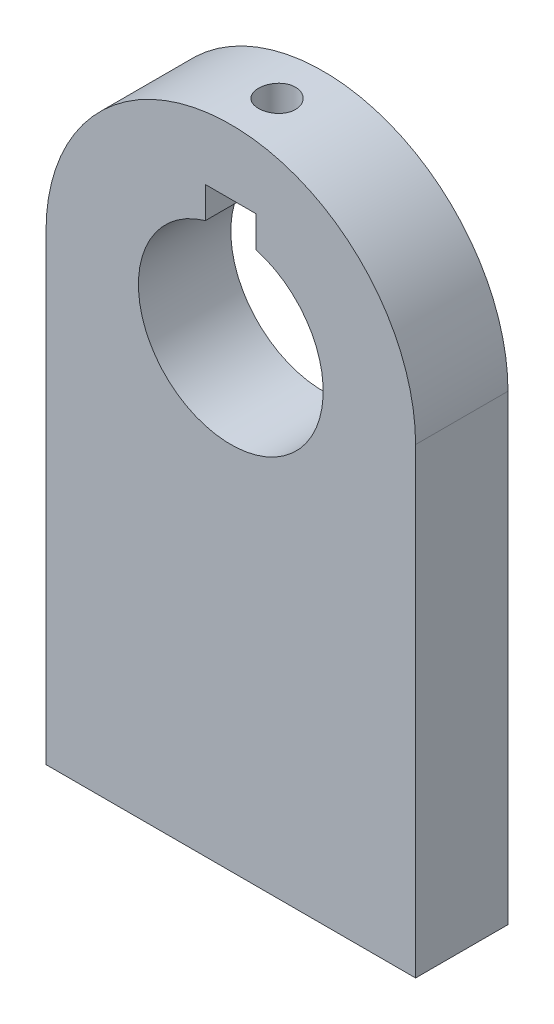
from build123d import *

# Parameters (mm, degrees)
SKETCH1_R           = 10
BOSS_EXTRUDE1_DEPTH = 10
SKETCH3_W           = 5.5
SKETCH3_H           = 3.5
CUT_EXTRUDE2_DEPTH  = 11
SKETCH4_R           = 2
CUT_EXTRUDE3_DEPTH  = 7


with BuildPart() as part:
    # Sketch1 → Boss-Extrude1 (new body)
    with BuildSketch(Plane.XY):
        with BuildLine():
            Line((-20, 0), (-20, -50))
            Line((-20, -50), (20, -50))
            Line((20, -50), (20, 0))
            ThreePointArc((20, 0), (0, 20), (-20, 0))
        make_face()
        Circle(SKETCH1_R, mode=Mode.SUBTRACT)
    extrude(amount=BOSS_EXTRUDE1_DEPTH)

    # Sketch3 → Cut-Extrude2 (cut)
    with BuildSketch(Plane.XY.offset(10)):
        with Locations((0, 11.25)):
            Rectangle(SKETCH3_W, SKETCH3_H)
    extrude(amount=-CUT_EXTRUDE2_DEPTH, mode=Mode.SUBTRACT)

    # Sketch4 → Cut-Extrude3 (cut)
    with BuildSketch(Plane.XZ.offset(-13)):
        with Locations(Location((0, 5, 0), (0, 0, 270))):
            Circle(SKETCH4_R)
    extrude(amount=-CUT_EXTRUDE3_DEPTH, mode=Mode.SUBTRACT)


solid = part.part
